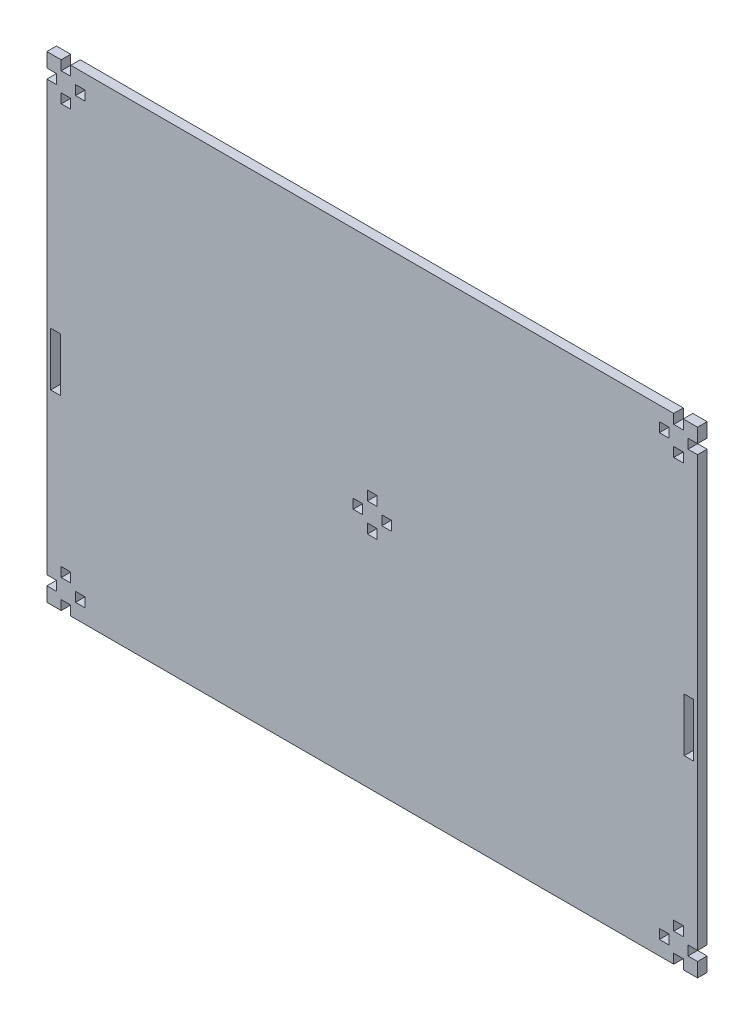
from build123d import *

# Parameters (mm, degrees)
SKETCH1_W           = 5
SKETCH1_H           = 28.000000001
SKETCH1_H_2         = 5
BOSS_EXTRUDE1_DEPTH = 5


with BuildPart() as part:
    # Sketch1 → Boss-Extrude1 (new body)
    with BuildSketch(Plane.XY):
        Polygon((331, 10), (323.5, 10), (323.5, 5), (318.5, 5), (318.5, 10), (2.5, 10), (2.5, 5), (-2.5, 5), (-2.5, 10), (-10, 10), (-10, 2.5), (-5, 2.5), (-5, -2.5), (-10, -2.5), (-10, -227.5), (-5, -227.5), (-5, -232.5), (-10, -232.5), (-10, -240), (-2.5, -240), (-2.5, -235), (2.5, -235), (2.5, -240), (318.5, -240), (318.5, -235), (323.5, -235), (323.5, -240), (331, -240), (331, -232.5), (326, -232.5), (326, -227.5), (331, -227.5), (331, -2.5), (326, -2.5), (326, 2.5), (331, 2.5), align=None)
        with Locations((-5.5, -128.600000001)):
            Rectangle(SKETCH1_W, SKETCH1_H, mode=Mode.SUBTRACT)
        with Locations((326.5, -128.600000001)):
            Rectangle(SKETCH1_W, SKETCH1_H, mode=Mode.SUBTRACT)
        with Locations((313.5, 0)):
            Rectangle(SKETCH1_W, SKETCH1_H_2, mode=Mode.SUBTRACT)
        with Locations((321, -7.5)):
            Rectangle(SKETCH1_W, SKETCH1_H_2, mode=Mode.SUBTRACT)
        with Locations((0, -7.5)):
            Rectangle(SKETCH1_W, SKETCH1_H_2, mode=Mode.SUBTRACT)
        with Locations((7.5, 0)):
            Rectangle(SKETCH1_W, SKETCH1_H_2, mode=Mode.SUBTRACT)
        with Locations((160.5, -122.5)):
            Rectangle(SKETCH1_W, SKETCH1_H_2, mode=Mode.SUBTRACT)
        with Locations((168, -115)):
            Rectangle(SKETCH1_W, SKETCH1_H_2, mode=Mode.SUBTRACT)
        with Locations((153, -115)):
            Rectangle(SKETCH1_W, SKETCH1_H_2, mode=Mode.SUBTRACT)
        with Locations((160.5, -107.5)):
            Rectangle(SKETCH1_W, SKETCH1_H_2, mode=Mode.SUBTRACT)
        with Locations((7.5, -230)):
            Rectangle(SKETCH1_W, SKETCH1_H_2, mode=Mode.SUBTRACT)
        with Locations((0, -222.5)):
            Rectangle(SKETCH1_W, SKETCH1_H_2, mode=Mode.SUBTRACT)
        with Locations((321, -222.5)):
            Rectangle(SKETCH1_W, SKETCH1_H_2, mode=Mode.SUBTRACT)
        with Locations((313.5, -230)):
            Rectangle(SKETCH1_W, SKETCH1_H_2, mode=Mode.SUBTRACT)
    extrude(amount=BOSS_EXTRUDE1_DEPTH)


solid = part.part
